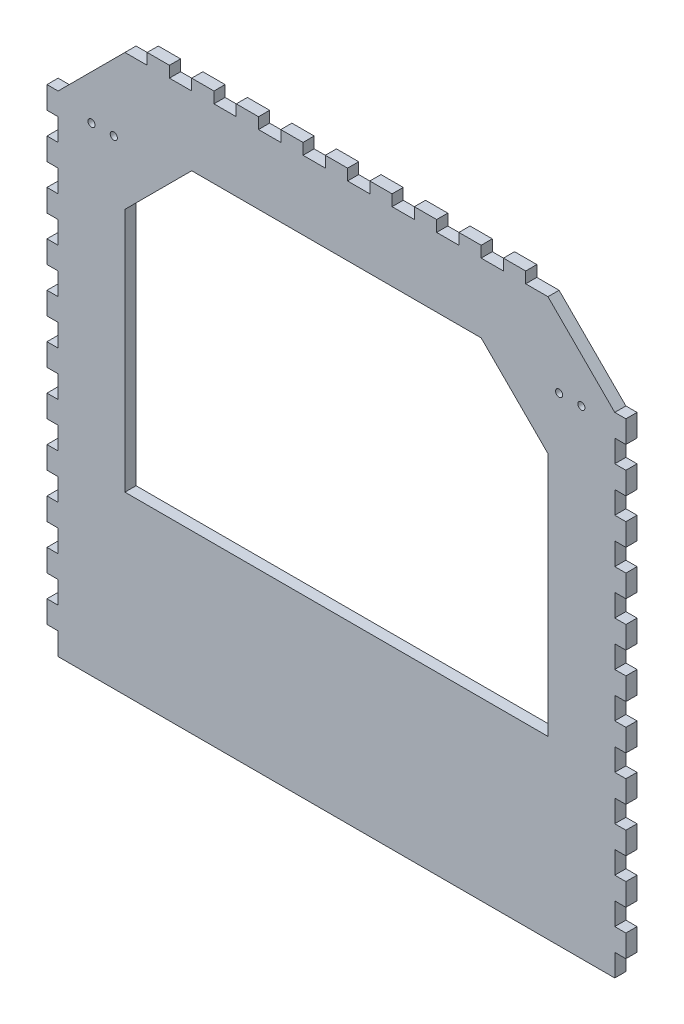
from build123d import *

# Parameters (mm, degrees)
SKIZZE1_R                       = 1.6
AUFSATZ_LINEAR_AUSTRAGEN1_DEPTH = 5


with BuildPart() as part:
    # Skizze1 → Aufsatz-Linear austragen1 (new body)
    with BuildSketch(Plane.XY):
        Polygon((35, 250), (45, 250), (45, 255), (55, 255), (55, 250), (65, 250), (65, 255), (75, 255), (75, 250), (85, 250), (85, 255), (95, 255), (95, 250), (105, 250), (105, 255), (115, 255), (115, 250), (125, 250), (125, 255), (135, 255), (135, 250), (145, 250), (145, 255), (155, 255), (155, 250), (165, 250), (165, 255), (175, 255), (175, 250), (185, 250), (185, 255), (195, 255), (195, 250), (205, 250), (205, 255), (215, 255), (215, 250), (225, 250), (255, 220), (260, 220), (260, 210), (255, 210), (255, 200), (260, 200), (260, 190), (255, 190), (255, 180), (260, 180), (260, 170), (255, 170), (255, 160), (260, 160), (260, 150), (255, 150), (255, 140), (260, 140), (260, 130), (255, 130), (255, 120), (260, 120), (260, 110), (255, 110), (255, 100), (260, 100), (260, 90), (255, 90), (255, 80), (260, 80), (260, 70), (255, 70), (255, 60), (260, 60), (260, 50), (255, 50), (255, 40), (260, 40), (260, 30), (255, 30), (255, 20), (260, 20), (260, 10), (255, 10), (255, 0), (5, 0), (5, 10), (0, 10), (0, 20), (5, 20), (5, 30), (0, 30), (0, 40), (5, 40), (5, 50), (0, 50), (0, 60), (5, 60), (5, 70), (0, 70), (0, 80), (5, 80), (5, 90), (0, 90), (0, 100), (5, 100), (5, 110), (0, 110), (0, 120), (5, 120), (5, 130), (0, 130), (0, 140), (5, 140), (5, 150), (0, 150), (0, 160), (5, 160), (5, 170), (0, 170), (0, 180), (5, 180), (5, 190), (0, 190), (0, 200), (5, 200), (5, 210), (0, 210), (0, 220), (5, 220), align=None)
        with Locations((20, 215)):
            Circle(SKIZZE1_R, mode=Mode.SUBTRACT)
        with Locations((30, 215)):
            Circle(SKIZZE1_R, mode=Mode.SUBTRACT)
        with Locations((240, 215)):
            Circle(SKIZZE1_R, mode=Mode.SUBTRACT)
        with Locations((230, 215)):
            Circle(SKIZZE1_R, mode=Mode.SUBTRACT)
        Polygon((65, 218.971165398), (195, 218.971165398), (225, 188.971165398), (225, 78.971165398), (35, 78.971165398), (35, 188.971165398), align=None, mode=Mode.SUBTRACT)
    extrude(amount=AUFSATZ_LINEAR_AUSTRAGEN1_DEPTH)


solid = part.part
